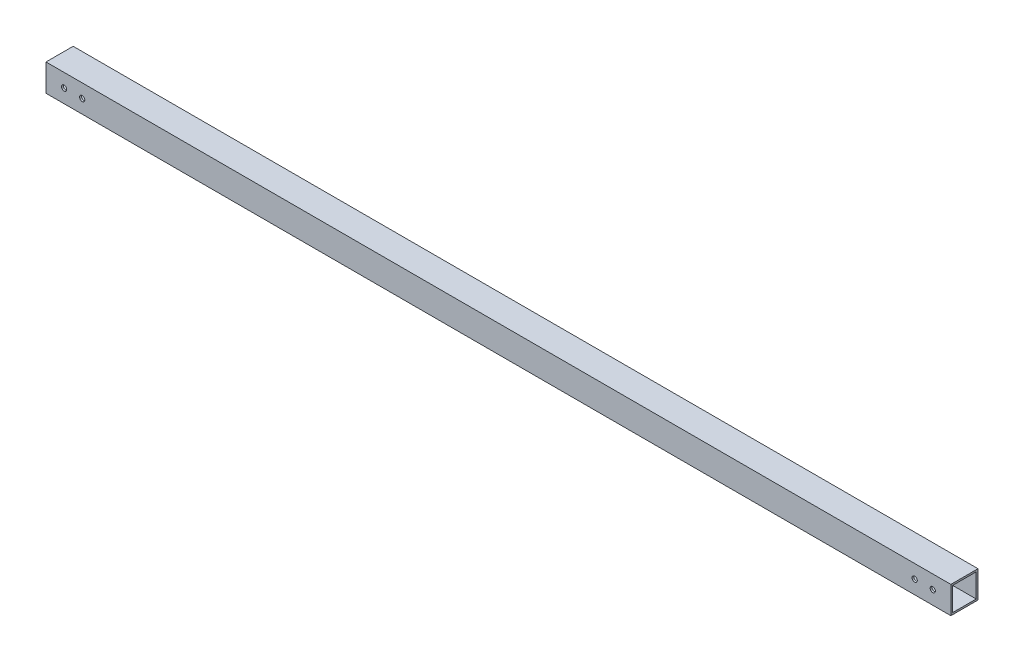
from build123d import *

# Parameters (mm, degrees)
SKETCH_1_W          = 15
SKETCH_1_H          = 15
SKETCH_1_W_2        = 13
SKETCH_1_H_2        = 13
EXTRUDE_1_DEPTH     = 500
SKETCH_2_R          = 1.45
CUT_EXTRUDE_1_DEPTH = 501.281170943


with BuildPart() as part:
    # 草图1 → 凸台-拉伸1 (new body)
    with BuildSketch(Plane(origin=(0, 0, 0), x_dir=(0, 0, -1), z_dir=(1, 0, 0))):
        Rectangle(SKETCH_1_W, SKETCH_1_H)
        Rectangle(SKETCH_1_W_2, SKETCH_1_H_2, mode=Mode.SUBTRACT)
    extrude(amount=EXTRUDE_1_DEPTH)

    # 草图2 → 切除-拉伸1 (cut, through all)
    with BuildSketch(Plane.XY.offset(7.5)):
        with Locations((490, 0)):
            Circle(SKETCH_2_R)
        with Locations((480, 0)):
            Circle(SKETCH_2_R)
        with Locations((10, 0)):
            Circle(SKETCH_2_R)
        with Locations((20, 0)):
            Circle(SKETCH_2_R)
    extrude(amount=-CUT_EXTRUDE_1_DEPTH, mode=Mode.SUBTRACT)


solid = part.part
